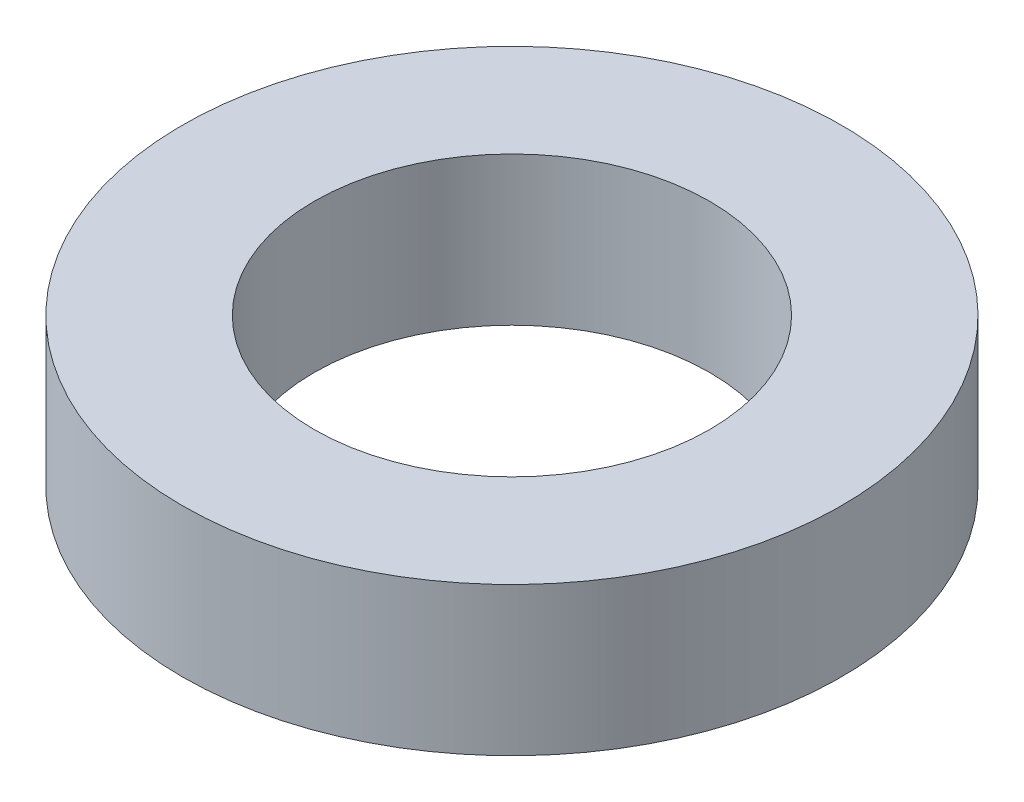
from build123d import *

# Parameters (mm, degrees)
SKETCH1_R           = 10
SKETCH1_R_2         = 6
BOSS_EXTRUDE1_DEPTH = 4.5


with BuildPart() as part:
    # Sketch1 → Boss-Extrude1 (new body)
    with BuildSketch(Plane(origin=(0, 0, 0), x_dir=(1, 0, 0), z_dir=(0, 1, 0))):
        with Locations(Location((0, 0, 0), (0, 0, 270))):
            Circle(SKETCH1_R)
        with Locations(Location((0, 0, 0), (0, 0, 270))):
            Circle(SKETCH1_R_2, mode=Mode.SUBTRACT)
    extrude(amount=BOSS_EXTRUDE1_DEPTH)


solid = part.part
